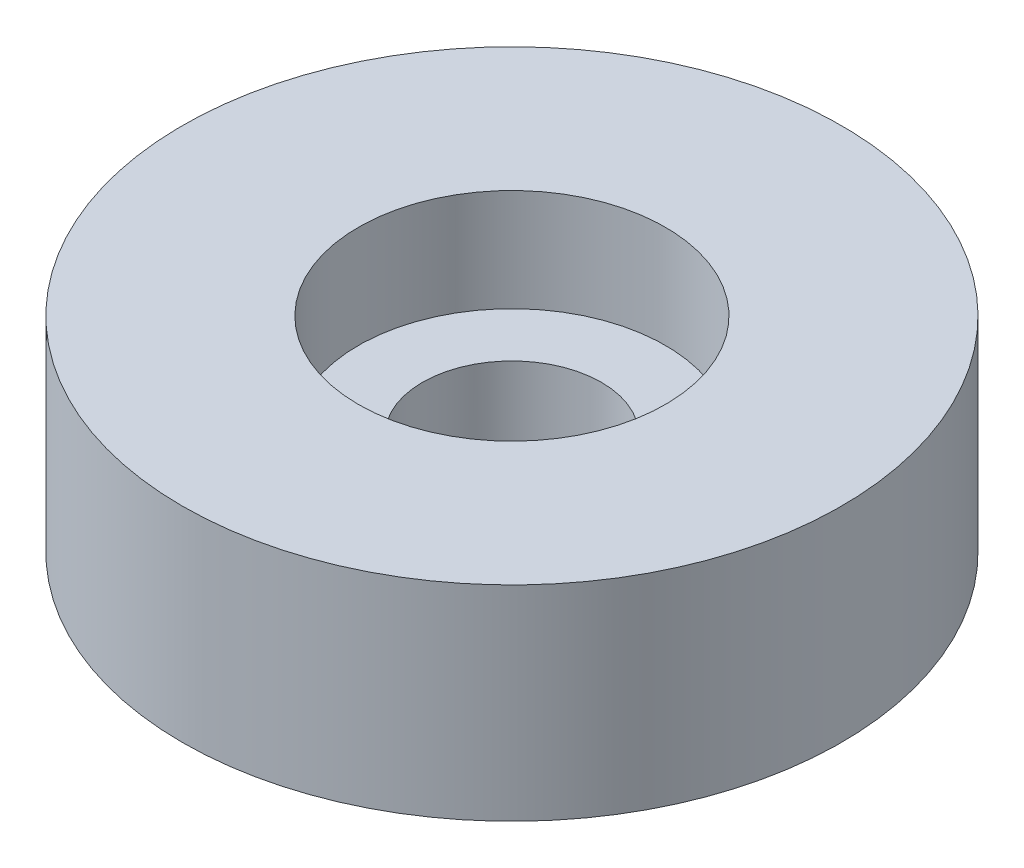
from build123d import *

# Parameters (mm, degrees)
SKETCH1_R           = 6.44
SKETCH1_R_2         = 1.75
BOSS_EXTRUDE1_DEPTH = 4
SKETCH2_R           = 3
CUT_EXTRUDE1_DEPTH  = 2
BOSS_EXTRUDE2_START = 0.5
SKETCH3_R           = 2.5
SKETCH3_R_2         = 1.75
BOSS_EXTRUDE2_DEPTH = 0.5


with BuildPart() as part:
    # Sketch1 → Boss-Extrude1 (new body)
    with BuildSketch(Plane(origin=(0, 0, 0), x_dir=(1, 0, 0), z_dir=(0, 1, 0))):
        with Locations(Location((0, 0, 0), (0, 0, 270))):
            Circle(SKETCH1_R)
        with Locations(Location((0, 0, 0), (0, 0, 270))):
            Circle(SKETCH1_R_2, mode=Mode.SUBTRACT)
    extrude(amount=BOSS_EXTRUDE1_DEPTH)

    # Sketch2 → Cut-Extrude1 (cut)
    with BuildSketch(Plane(origin=(0, 4, 0), x_dir=(1, 0, 0), z_dir=(0, 1, 0))):
        with Locations(Location((0, 0, 0), (0, 0, 270))):
            Circle(SKETCH2_R)
    extrude(amount=-CUT_EXTRUDE1_DEPTH, mode=Mode.SUBTRACT)

    # Sketch3 → Boss-Extrude2 (add)
    with BuildSketch(Plane.XZ.offset(BOSS_EXTRUDE2_START)):
        with Locations(Location((0, 0, 0), (0, 0, 90))):
            Circle(SKETCH3_R)
        with Locations(Location((0, 0, 0), (0, 0, 270))):
            Circle(SKETCH3_R_2, mode=Mode.SUBTRACT)
    extrude(amount=-BOSS_EXTRUDE2_DEPTH)


solid = part.part
